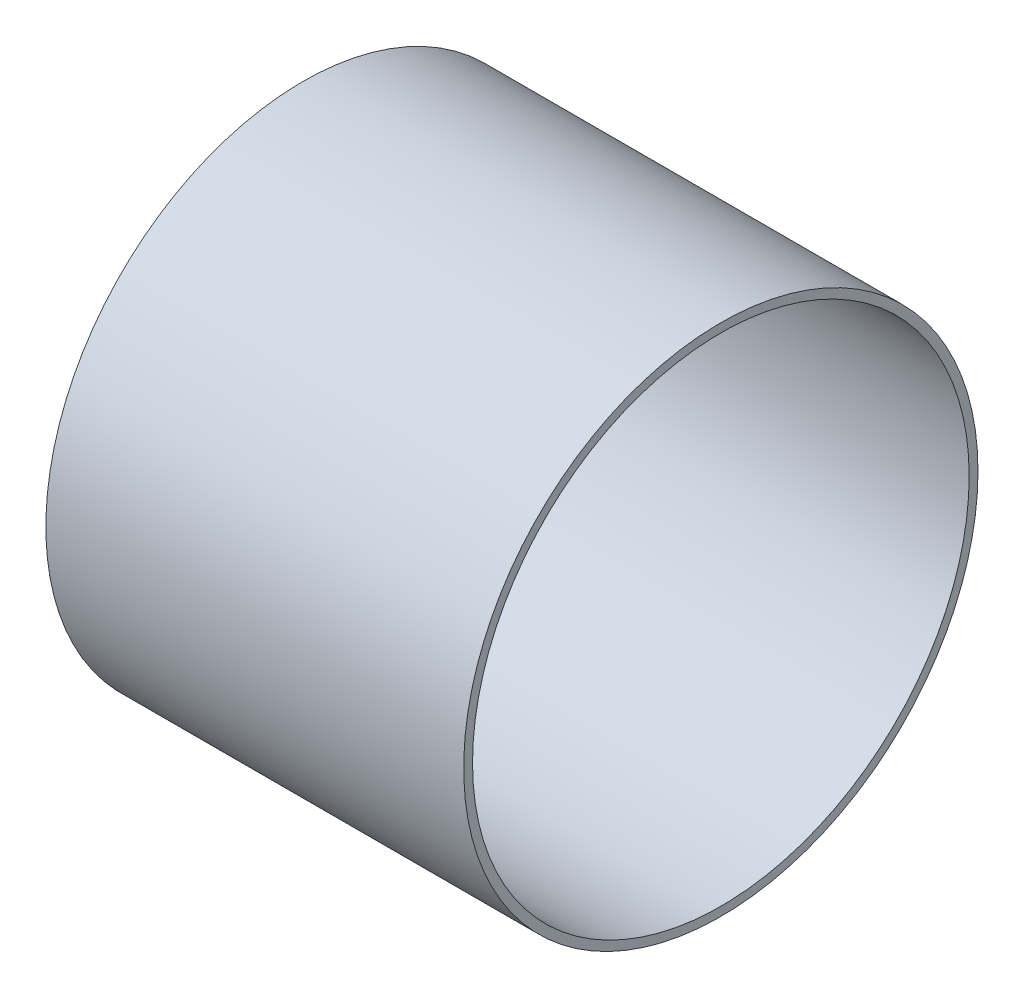
from build123d import *

# Parameters (mm, degrees)
SKETCH1_R      = 109.5375
SKETCH1_R_2    = 105.7783
EXTRUDE1_DEPTH = 89


with BuildPart() as part:
    # Sketch1 → Extrude1 (new, symmetric)
    with BuildSketch(Plane(origin=(0, 0, 0), x_dir=(0, 0, -1), z_dir=(1, 0, 0))):
        Circle(SKETCH1_R)
        Circle(SKETCH1_R_2, mode=Mode.SUBTRACT)
    extrude(amount=EXTRUDE1_DEPTH, both=True)


solid = part.part
